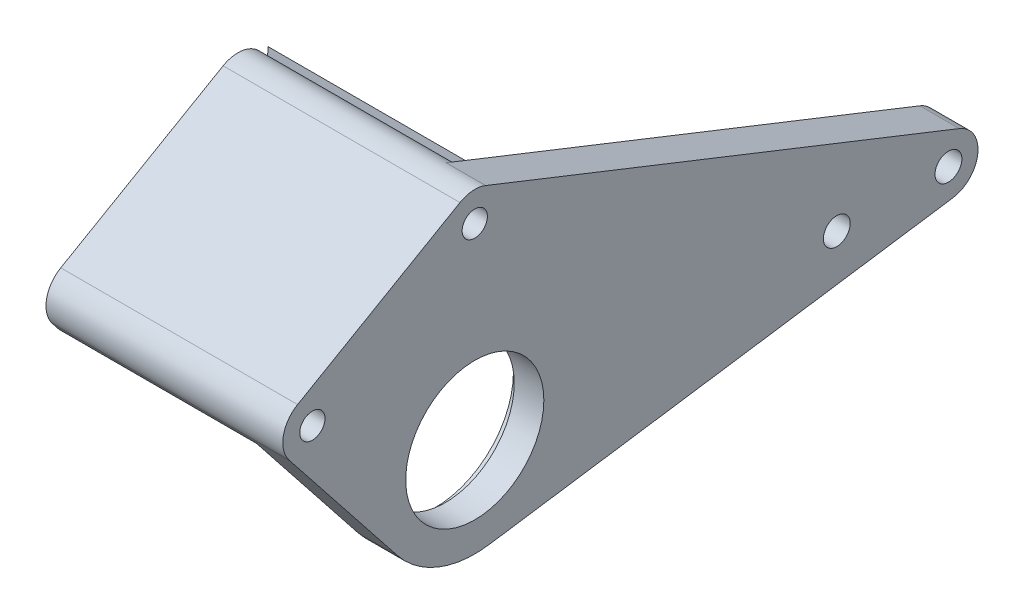
from build123d import *

# Parameters (mm, degrees)
SKETCH1_R           = 2.159
SKETCH1_R_2         = 11.112499999999992
SKETCH1_R_3         = 2.032000000000007
SKETCH1_R_4         = 2.0320000000000227
SKETCH1_R_5         = 2.159000000000001
BOSS_EXTRUDE1_DEPTH = 6.35
SKETCH2_R           = 12.573000000000004
CUT_EXTRUDE1_DEPTH  = 1.5875
BOSS_EXTRUDE2_DEPTH = 31.75
FILLET1_R           = 3.175


with BuildPart() as part:
    # Sketch1 → Boss-Extrude1 (new body)
    with BuildSketch(Plane(origin=(0, 0, 0), x_dir=(0, 0, -1), z_dir=(1, 0, 0))):
        with BuildLine():
            Line((1.7528307479226393, 4.428203994751931), (-74.44716925207737, 34.59070399475192))
            ThreePointArc((-74.44716925207737, 34.59070399475192), (-76.54899129091997, 34.912195919620736), (-78.58125, 34.28694598552338))
            Line((-78.58125, 34.28694598552338), (-104.70274124164806, 19.205695985523498))
            ThreePointArc((-104.70274124164806, 19.205695985523498), (-106.99949191381467, 15.974399461853373), (-106.05477455872966, 12.124224142081344))
            Line((-106.05477455872966, 12.124224142081344), (-88.64427772360533, -9.856752859729227))
            ThreePointArc((-88.64427772360533, -9.856752859729227), (-82.04819337667968, -14.758531743671528), (-73.88489583333335, -15.705283114209777))
            Line((-73.88489583333335, -15.705283114209777), (0.6945312500000005, -4.711584934262932))
            ThreePointArc((0.6945312500000005, -4.711584934262932), (4.730891100411702, -0.5477916082283132), (1.7528307479226393, 4.428203994751931))
        make_face()
        Circle(SKETCH1_R, mode=Mode.SUBTRACT)
        with Locations((-76.2, -9.33e-15)):
            Circle(SKETCH1_R_2, mode=Mode.SUBTRACT)
        with Locations((-76.2, 30.162499999999987)):
            Circle(SKETCH1_R_3, mode=Mode.SUBTRACT)
        with Locations((-102.32149124164806, 15.081250000000113)):
            Circle(SKETCH1_R_4, mode=Mode.SUBTRACT)
        with Locations((-17.960512242138307, -2.2e-15)):
            Circle(SKETCH1_R_5, mode=Mode.SUBTRACT)
    extrude(amount=BOSS_EXTRUDE1_DEPTH)

    # Sketch2 → Cut-Extrude1 (cut)
    with BuildSketch(Plane(origin=(6.35, 0, 0), x_dir=(0, 0, -1), z_dir=(1, 0, 0))):
        with Locations((-76.2, -9.33e-15)):
            Circle(SKETCH2_R)
    extrude(amount=-CUT_EXTRUDE1_DEPTH, mode=Mode.SUBTRACT)

    # Sketch3 → Boss-Extrude2 (add)
    with BuildSketch(Plane(origin=(6.35, 0, 0), x_dir=(0, 0, -1), z_dir=(1, 0, 0))):
        with BuildLine():
            Line((-78.58125000000001, 34.286945985523374), (-104.70274124164803, 19.20569598552344))
            ThreePointArc((-104.70274124164803, 19.20569598552344), (-106.9994919138146, 15.974399461853357), (-106.05477455872966, 12.124224142081344))
            Line((-106.05477455872966, 12.124224142081344), (-101.58067912721546, 6.475620904888487))
            ThreePointArc((-101.58067912721546, 6.475620904888487), (-90.28737650298505, 22.08298807511437), (-71.374, 25.745334782490193))
            Line((-71.374, 25.745334782490193), (-71.374, 33.37424116580463))
            Line((-71.374, 33.37424116580463), (-71.46391508012837, 30.663405062626204))
            ThreePointArc((-71.46391508012837, 30.663405062626204), (-74.0392538140866, 34.40662325104498), (-78.58125000000001, 34.286945985523374))
        make_face()
        Polygon((-76.19999999999999, 33.901997693541205), (-79.4385, 32.03224884677059), (-79.4385, 28.292751153229368), (-76.20000000000002, 26.42300230645877), (-72.9615, 28.292751153229386), (-72.9615, 32.03224884677061), align=None, mode=Mode.SUBTRACT)
        Polygon((-102.32149124164808, 18.820747693541325), (-105.55999124164805, 16.950998846770727), (-105.55999124164805, 13.211501153229527), (-102.32149124164805, 11.341752306458922), (-99.08299124164807, 13.211501153229516), (-99.08299124164807, 16.95099884677072), align=None, mode=Mode.SUBTRACT)
    extrude(amount=BOSS_EXTRUDE2_DEPTH)

    # Fillet1
    fillet1_edges = [part.edges().sort_by_distance(p)[0] for p in [
        (22.225, 25.745334782490197, 71.374),
        (22.225, 6.475620904888487, 101.58067912721546),
    ]]
    fillet(fillet1_edges, radius=FILLET1_R)


with BuildPart() as body_2:
    # Mirror1: mirrored copy
    add(part.part.mirror(Plane(origin=(6.35, 0, 0), x_dir=(0, 0, 1), z_dir=(1, 0, 0))))


solid = body_2.part
